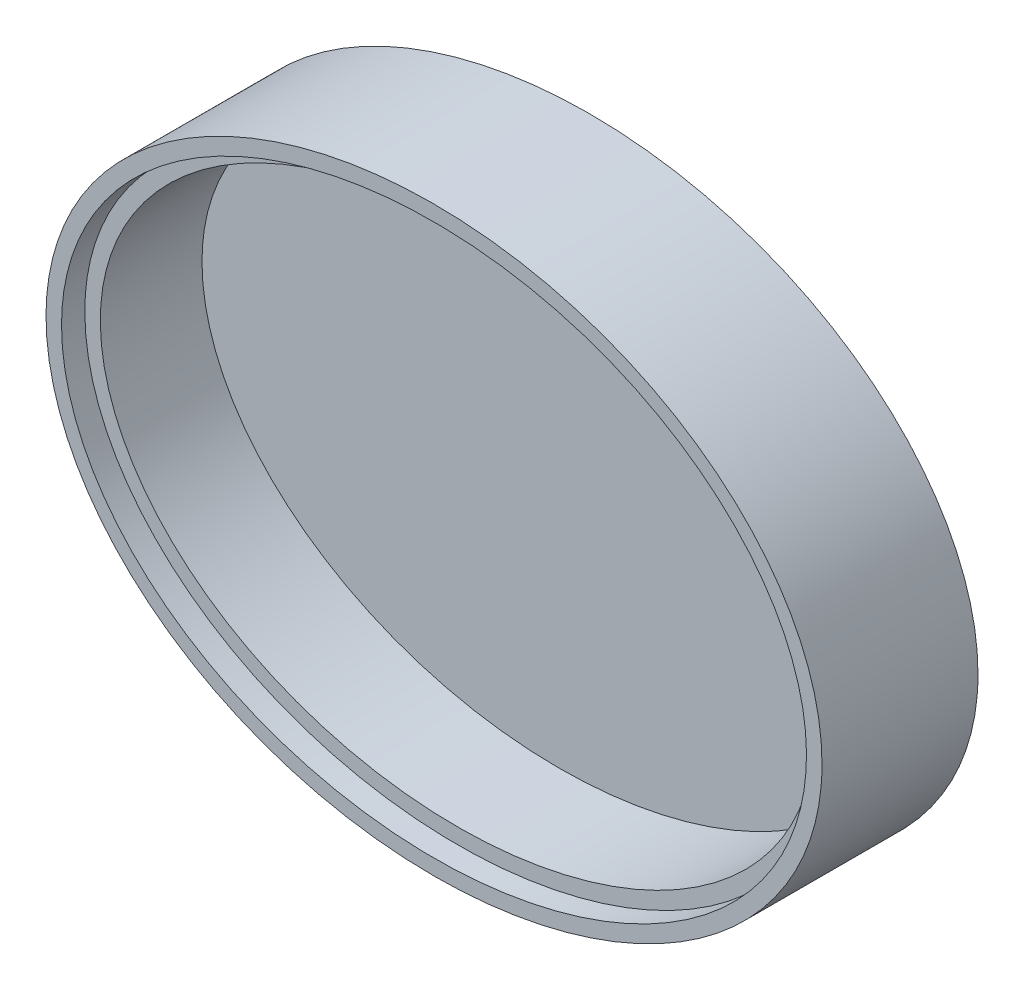
from build123d import *

# Parameters (mm, degrees)
SKETCH1_RX          = 50
SKETCH1_RY          = 37.5
BOSS_EXTRUDE1_DEPTH = 20.1
SHELL1_T            = -4
SKETCH2_RX          = 48
SKETCH2_RY          = 35.5
CUT_EXTRUDE1_DEPTH  = 3


with BuildPart() as part:
    # Sketch1 → Boss-Extrude1 (new body)
    with BuildSketch(Plane.XY):
        with Locations((0, 0)):
            Ellipse(SKETCH1_RX, SKETCH1_RY)
    extrude(amount=BOSS_EXTRUDE1_DEPTH)

    # Shell1
    shell1_openings = [part.faces().sort_by_distance(p)[0] for p in [
        (0, 0, 20.1),
    ]]
    offset(amount=SHELL1_T, openings=shell1_openings, kind=Kind.INTERSECTION)

    # Sketch2 → Cut-Extrude1 (cut)
    with BuildSketch(Plane.XY.offset(20.1)):
        with Locations(Location((0, 0), (0, 0, 180))):
            Ellipse(SKETCH2_RX, SKETCH2_RY)
    extrude(amount=-CUT_EXTRUDE1_DEPTH, mode=Mode.SUBTRACT)


solid = part.part
